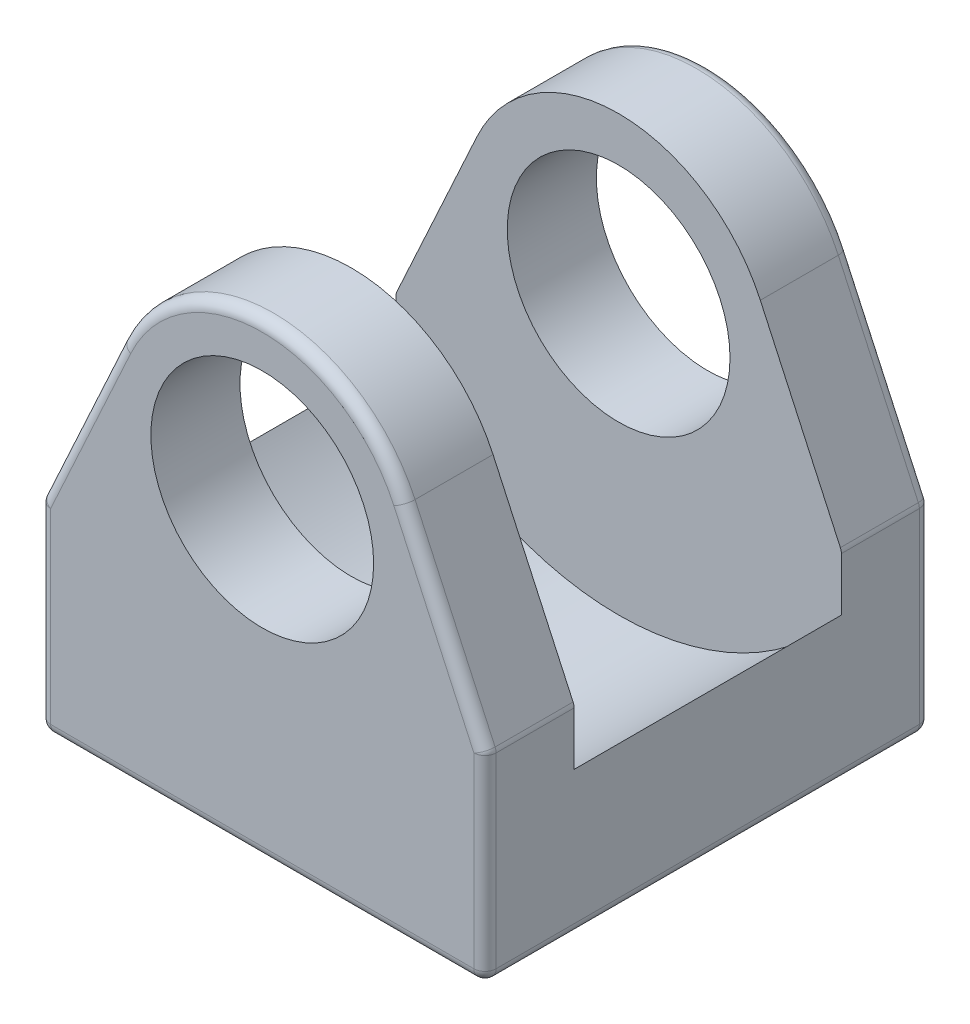
from build123d import *

# Parameters (mm, degrees)
SKETCH_1_R          = 5
EXTRUDE_1_DEPTH     = 10
FILLET_1_R          = 0.5
SKETCH_3_R          = 12.5
CUT_EXTRUDE_1_DEPTH = 6


with BuildPart() as part:
    # 草图1 → 凸台-拉伸1 (new, symmetric)
    with BuildSketch(Plane.XY):
        with BuildLine():
            Line((6.360983408, 12.421966817), (10, 4.5))
            Line((10, 4.5), (10, -4.5))
            Line((10, -4.5), (-10, -4.5))
            Line((-10, -4.5), (-10, 4.5))
            Line((-10, 4.5), (-6.360983408, 12.421966817))
            ThreePointArc((-6.360983408, 12.421966817), (0, 16.5), (6.360983408, 12.421966817))
        make_face()
        with Locations((0, 9.5)):
            Circle(SKETCH_1_R, mode=Mode.SUBTRACT)
    extrude(amount=EXTRUDE_1_DEPTH, both=True)

    # 圆角1
    fillet_1_edges = [part.edges().sort_by_distance(p)[0] for p in [
        (10, -4.5, 0),
        (-10, -4.5, 0),
        (-10, 4.5, 0),
        (10, 4.5, 0),
        (0, 16.5, 10),
        (-8.180491704, 8.460983408, 10),
        (-10, 0, 10),
        (0, -4.5, 10),
        (10, 0, 10),
        (0, -4.5, -10),
        (-10, 0, -10),
        (-8.180491704, 8.460983408, -10),
        (0, 16.5, -10),
        (8.180491704, 8.460983408, -10),
        (10, 0, -10),
        (8.180491704, 8.460983408, 10),
    ]]
    fillet(fillet_1_edges, radius=FILLET_1_R)

    # 草图3 → 切除-拉伸1 (cut, symmetric)
    with BuildSketch(Plane.XY):
        with Locations((0, 9.5)):
            Circle(SKETCH_3_R)
    extrude(amount=CUT_EXTRUDE_1_DEPTH, both=True, mode=Mode.SUBTRACT)


solid = part.part
